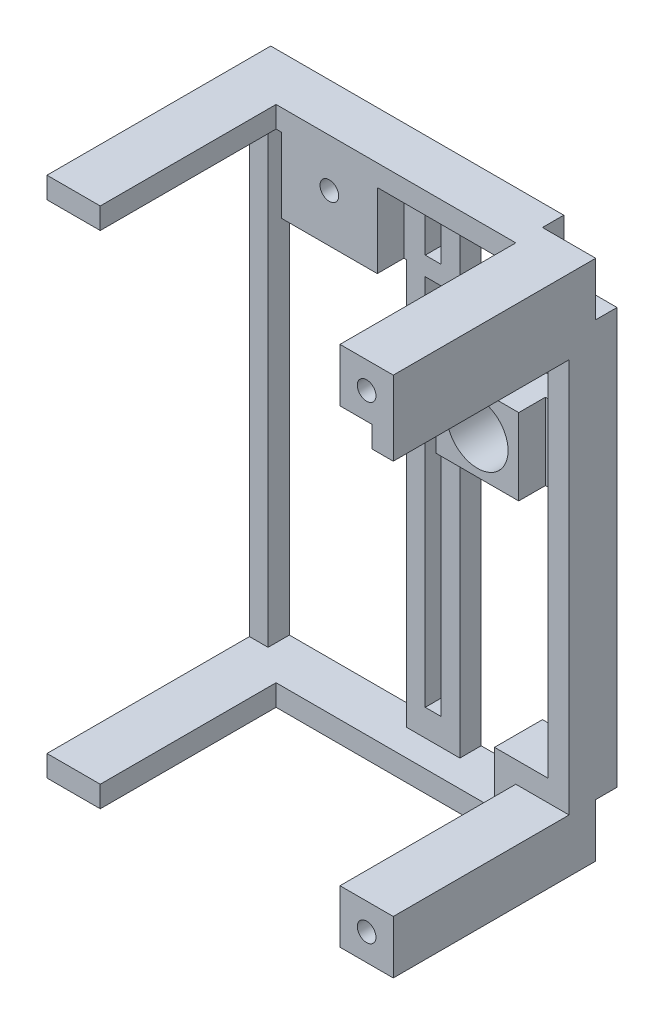
from build123d import *

# Parameters (mm, degrees)
SKETCH1_R           = 1.75
BOSS_EXTRUDE2_DEPTH = 5
SKETCH1_18_W        = 10
SKETCH1_18_H        = 10
BOSS_EXTRUDE4_DEPTH = 4
BOSS_EXTRUDE5_DEPTH = 38
SKETCH2_R           = 1.75
CUT_EXTRUDE1_DEPTH  = 125.871934397
SKETCH1_23_W        = 15.5
SKETCH1_23_H        = 14.371050284
SKETCH1_23_R        = 5.75
BOSS_EXTRUDE6_DEPTH = 5
SKETCH1_25_R        = 5.75
CUT_EXTRUDE4_DEPTH  = 124.583979544
SKETCH9_W           = 45
SKETCH9_H           = 4
SKETCH9_W_2         = 4
SKETCH9_H_2         = 74
CUT_EXTRUDE6_DEPTH  = 33
SKETCH10_W          = 3
SKETCH10_H          = 11.5
CUT_EXTRUDE7_DEPTH  = 124.583979544


with BuildPart() as part:
    # Sketch1 → Boss-Extrude2 (new body)
    with BuildSketch(Plane.XY):
        Polygon((0, 98), (0, 94), (11, 94), (11, 80), (29, 80), (29, 94), (51, 94), (51, 84), (61, 84), (61, 14), (51, 14), (51, 4), (0, 4), (0, 0), (65, 0), (65, 98), align=None)
        with Locations((20, 89)):
            Circle(SKETCH1_R, mode=Mode.SUBTRACT)
    extrude(amount=BOSS_EXTRUDE2_DEPTH)

    # Sketch1<18> → Boss-Extrude4 (add)
    with BuildSketch(Plane.XY):
        Polygon((0, 98), (0, 0), (55, 0), (55, 10), (65, 10), (65, 88), (55, 88), (55, 98), align=None)
        with Locations((20, 89)):
            Rectangle(SKETCH1_18_W, SKETCH1_18_H, mode=Mode.SUBTRACT)
        Polygon((36, 9), (33, 9), (33, 79), (36, 79), (36, 70.661486956), align=None, mode=Mode.SUBTRACT)
    extrude(amount=-BOSS_EXTRUDE4_DEPTH)

    # Sketch1<22> → Boss-Extrude5 (add)
    with BuildSketch(Plane.XY):
        Polygon((0, 98), (0, 94), (55, 94), (55, 88), (61, 88), (61, 10), (55, 10), (55, 4), (0, 4), (0, 0), (65, 0), (65, 98), align=None)
    extrude(amount=BOSS_EXTRUDE5_DEPTH)

    # Sketch2 → Cut-Extrude1 (cut, through all)
    with BuildSketch(Plane.XY.offset(38)):
        with Locations((60, 93)):
            Circle(SKETCH2_R)
        with Locations((60, 5)):
            Circle(SKETCH2_R)
    extrude(amount=-CUT_EXTRUDE1_DEPTH, mode=Mode.SUBTRACT)

    # Sketch1<23> → Boss-Extrude6 (add)
    with BuildSketch(Plane.XY):
        with Locations((47.8, 63.5)):
            Rectangle(SKETCH1_23_W, SKETCH1_23_H)
        with Locations((47.8, 63.5)):
            Circle(SKETCH1_23_R, mode=Mode.SUBTRACT)
    extrude(amount=BOSS_EXTRUDE6_DEPTH)

    # Sketch1<25> → Cut-Extrude4 (cut, through all)
    with BuildSketch(Plane.XY):
        with Locations((47.8, 63.5)):
            Circle(SKETCH1_25_R)
    extrude(amount=-CUT_EXTRUDE4_DEPTH, mode=Mode.SUBTRACT)

    # Sketch9 → Cut-Extrude6 (cut)
    with BuildSketch(Plane.XY.offset(38)):
        with Locations((32.5, 2)):
            Rectangle(SKETCH9_W, SKETCH9_H)
        with Locations((32.5, 96)):
            Rectangle(SKETCH9_W, SKETCH9_H)
        with Locations((63, 47)):
            Rectangle(SKETCH9_W_2, SKETCH9_H_2)
    extrude(amount=-CUT_EXTRUDE6_DEPTH, mode=Mode.SUBTRACT)

    # Sketch10 → Cut-Extrude7 (cut, through all)
    with BuildSketch(Plane.XY):
        Polygon((11, 94), (3.5, 94), (3.5, 4), (29.5, 4), (29.5, 80), (11, 80), align=None)
        Polygon((39.5, 56.314474858), (39.5, 4), (51, 4), (51, 14), (61, 14), (61, 56.314474858), align=None)
        with Locations((34.5, 88.25)):
            Rectangle(SKETCH10_W, SKETCH10_H)
        Polygon((51, 94), (39.5, 94), (39.5, 70.685525142), (61, 70.685525142), (61, 84), (51, 84), align=None)
    extrude(amount=-CUT_EXTRUDE7_DEPTH, mode=Mode.SUBTRACT)


solid = part.part
